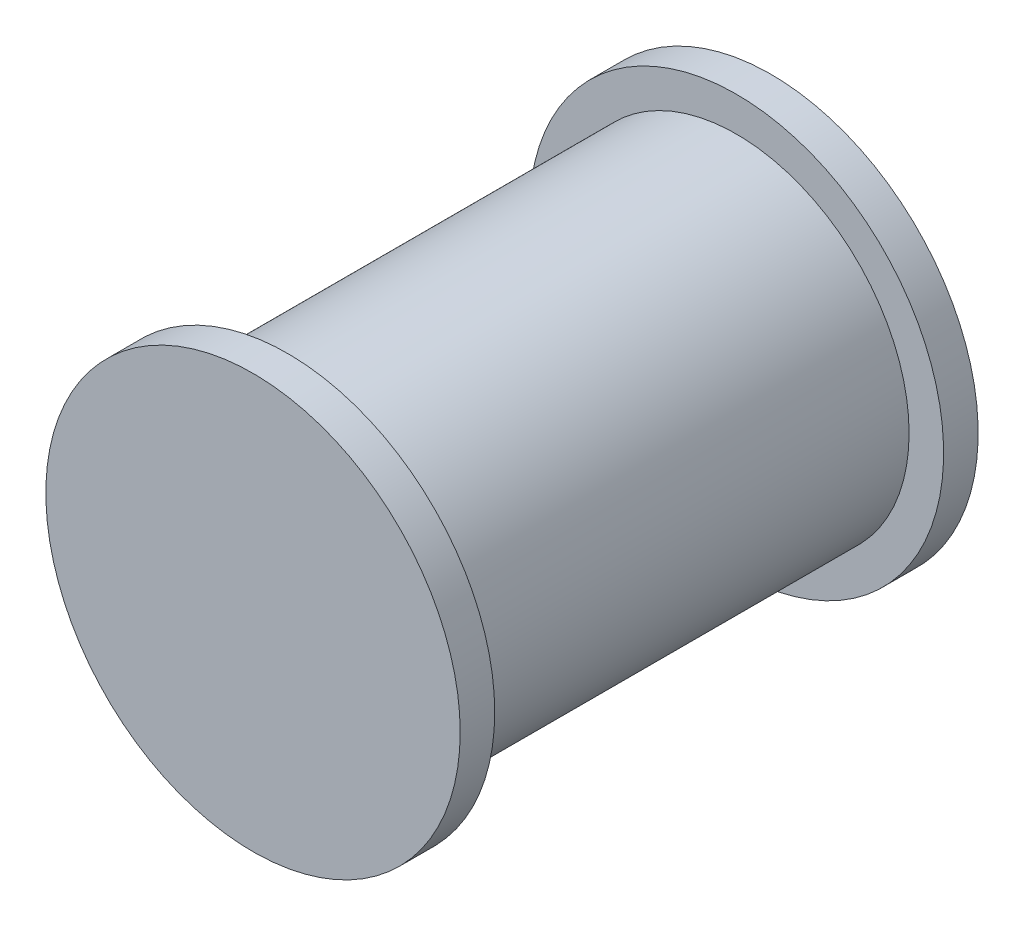
from build123d import *

# Parameters (mm, degrees)
SKETCH_1_R        = 10
EXTRUDE_1_DEPTH   = 30
EXTRUDE_START     = -2
SKETCH_2_R        = 12
SKETCH_2_R_2      = 10
EXTRUDE_1_2_DEPTH = 2
SKETCH_3_R        = 12
SKETCH_3_R_2      = 10
EXTRUDE_2_DEPTH   = 2


with BuildPart() as part:
    # 草图1 → Extrude 1 (new body)
    with BuildSketch(Plane.XY):
        Circle(SKETCH_1_R)
    extrude(amount=EXTRUDE_1_DEPTH)

    # 草图2 → Extrude 1 2 (add)
    with BuildSketch(Plane.XY.offset(30).offset(EXTRUDE_START)):
        Circle(SKETCH_2_R)
        Circle(SKETCH_2_R_2, mode=Mode.SUBTRACT)
    extrude(amount=EXTRUDE_1_2_DEPTH)

    # 草图3 → 拉伸-薄壁2 (add)
    with BuildSketch(Plane(origin=(0, 0, 0), x_dir=(-1, 0, 0), z_dir=(0, 0, -1))):
        Circle(SKETCH_3_R)
        Circle(SKETCH_3_R_2, mode=Mode.SUBTRACT)
    extrude(amount=-EXTRUDE_2_DEPTH)


solid = part.part
